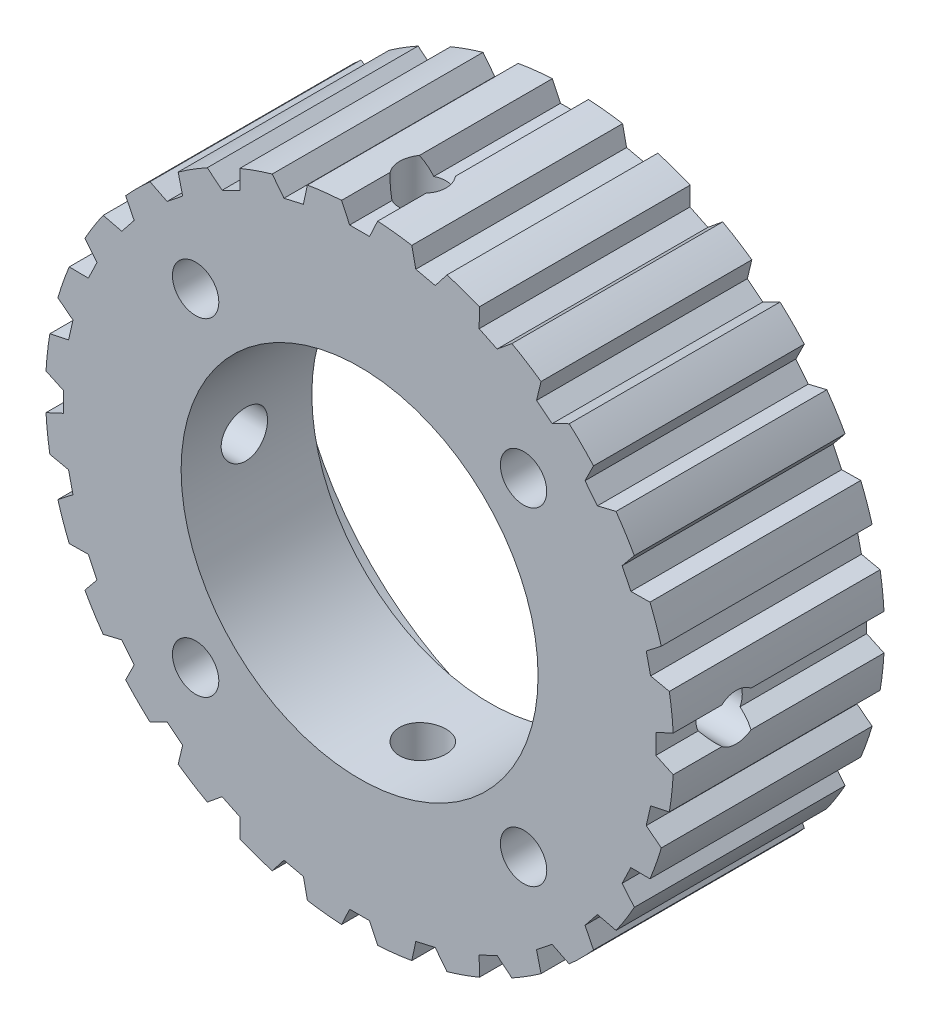
from build123d import *

# Parameters (mm, degrees)
SKETCH1_W                 = 22.35
SKETCH1_H                 = 15
CUT_EXTRUDE1_DEPTH        = 35.986354483
CUT_EXTRUDE2_DEPTH        = 35.986354483
CUT_EXTRUDE3_DEPTH        = 35.986354483
CUT_EXTRUDE4_DEPTH        = 35.986354483
CUT_EXTRUDE5_DEPTH        = 35.986354483
CUT_EXTRUDE6_DEPTH        = 35.986354483
CUT_EXTRUDE7_DEPTH        = 35.986354483
CUT_EXTRUDE8_DEPTH        = 35.986354483
CUT_EXTRUDE9_DEPTH        = 35.986354483
CUT_EXTRUDE10_DEPTH       = 35.986354483
CUT_EXTRUDE11_DEPTH       = 35.986354483
CUT_EXTRUDE12_DEPTH       = 35.986354483
CUT_EXTRUDE13_DEPTH       = 35.986354483
CUT_EXTRUDE14_DEPTH       = 35.986354483
CUT_EXTRUDE15_DEPTH       = 35.986354483
CUT_EXTRUDE16_DEPTH       = 35.986354483
CUT_EXTRUDE17_DEPTH       = 35.986354483
CUT_EXTRUDE18_DEPTH       = 35.986354483
CUT_EXTRUDE19_DEPTH       = 35.986354483
CUT_EXTRUDE20_DEPTH       = 35.986354483
CUT_EXTRUDE21_DEPTH       = 35.962828489
CUT_EXTRUDE22_DEPTH       = 35.962828489
CUT_EXTRUDE23_DEPTH       = 35.962828489
CUT_EXTRUDE24_DEPTH       = 35.962828489
CUT_EXTRUDE25_DEPTH       = 35.962828489
CUT_EXTRUDE26_DEPTH       = 35.962828489
CUT_EXTRUDE27_DEPTH       = 35.962828489
CUT_EXTRUDE28_DEPTH       = 35.939286654
DRAFT1_ANGLE              = 25
DRAFT2_ANGLE              = 25
DRAFT3_ANGLE              = 25
DRAFT4_ANGLE              = 25
DRAFT5_ANGLE              = 25
DRAFT6_ANGLE              = 25
DRAFT7_ANGLE              = 25
DRAFT8_ANGLE              = 25
HOLE1_D                   = 25.4
HOLE1_CBORE_D             = 40
HOLE1_CBORE_DEPTH         = 5.7
F_4_CLEARANCE_HOLE1_D     = 3.3
F_4_CLEARANCE_HOLE1_DEPTH = 9.72079598
F_4_CLEARANCE_HOLE2_D     = 3.3
F_4_CLEARANCE_HOLE2_DEPTH = 9.72079598
F_4_CLEARANCE_HOLE3_D     = 3.3
F_4_CLEARANCE_HOLE3_DEPTH = 9.72079598
F_4_CLEARANCE_HOLE4_D     = 3.3
F_4_CLEARANCE_HOLE4_DEPTH = 9.72079598
F_4_CLEARANCE_HOLE5_D     = 3.3
F_4_CLEARANCE_HOLE5_DEPTH = 15


with BuildPart() as part:
    # Sketch1 → Revolve1 (revolve)
    with BuildSketch(Plane.XZ, mode=Mode.PRIVATE) as revolve1_sk:
        with Locations((11.175, 7.5)):
            Rectangle(SKETCH1_W, SKETCH1_H)
    revolve(revolve1_sk.sketch.rotate(Axis((0, 0, 15), (0, 0, -1)), 180), axis=Axis((0, 0, 15), (0, 0, -1)))

    # Sketch2 → Cut-Extrude1 (cut, through all)
    with BuildSketch(Plane.XY.offset(15)):
        with BuildLine():
            Line((8.525535233, 20.660052008), (8.50857312, 19.299521992))
            Line((8.50857312, 19.299521992), (10.50433369, 19.27464028))
            Line((10.50433369, 19.27464028), (10.837094817, 19.546863583))
            ThreePointArc((10.837094817, 19.546863583), (9.697301569, 20.136654198), (8.525535233, 20.660052008))
        make_face()
    extrude(amount=-CUT_EXTRUDE1_DEPTH, mode=Mode.SUBTRACT)

    # Sketch3 → Cut-Extrude2 (cut, through all)
    with BuildSketch(Plane.XY.offset(15)):
        with BuildLine():
            Line((12.909076333, 18.244951308), (12.589793086, 16.922307045))
            Line((12.589793086, 16.922307045), (13.696536961, 16.039708256))
            Line((13.696536961, 16.039708256), (14.914972564, 16.645302443))
            ThreePointArc((14.914972564, 16.645302443), (13.934997072, 17.473933633), (12.909076333, 18.244951308))
        make_face()
    extrude(amount=-CUT_EXTRUDE2_DEPTH, mode=Mode.SUBTRACT)

    # Sketch4 → Cut-Extrude3 (cut, through all)
    with BuildSketch(Plane.XY.offset(15)):
        with BuildLine():
            Line((16.645302443, 14.914972564), (16.039708256, 13.696536961))
            Line((16.039708256, 13.696536961), (16.922307045, 12.589793086))
            Line((16.922307045, 12.589793086), (18.244951308, 12.909076333))
            ThreePointArc((18.244951308, 12.909076333), (17.473933633, 13.934997072), (16.645302443, 14.914972564))
        make_face()
    extrude(amount=-CUT_EXTRUDE3_DEPTH, mode=Mode.SUBTRACT)

    # Sketch5 → Cut-Extrude4 (cut, through all)
    with BuildSketch(Plane.XY.offset(15)):
        with BuildLine():
            Line((19.546863583, 10.837094817), (19.27464028, 10.50433369))
            Line((19.27464028, 10.50433369), (19.299521992, 8.50857312))
            Line((19.299521992, 8.50857312), (20.660052008, 8.525535233))
            ThreePointArc((20.660052008, 8.525535233), (20.136654198, 9.697301569), (19.546863583, 10.837094817))
        make_face()
    extrude(amount=-CUT_EXTRUDE4_DEPTH, mode=Mode.SUBTRACT)

    # Sketch6 → Cut-Extrude5 (cut, through all)
    with BuildSketch(Plane.XY.offset(15)):
        with BuildLine():
            Line((21.468263363, 6.215799883), (20.393982458, 5.380784807))
            Line((20.393982458, 5.380784807), (20.708978319, 4.000697768))
            Line((20.708978319, 4.000697768), (22.039171433, 3.714488196))
            ThreePointArc((22.039171433, 3.714488196), (21.789638837, 4.973342874), (21.468263363, 6.215799883))
        make_face()
    extrude(amount=-CUT_EXTRUDE5_DEPTH, mode=Mode.SUBTRACT)

    # Sketch7 → Cut-Extrude6 (cut, through all)
    with BuildSketch(Plane.XY.offset(15)):
        with BuildLine():
            Line((22.313154774, 1.282818789), (21.08, 0.707789274))
            Line((21.08, 0.707789274), (21.08, -0.707789274))
            Line((21.08, -0.707789274), (22.313154774, -1.282818789))
            ThreePointArc((22.313154774, -1.282818789), (22.35, 0), (22.313154774, 1.282818789))
        make_face()
    extrude(amount=-CUT_EXTRUDE6_DEPTH, mode=Mode.SUBTRACT)

    # Sketch8 → Cut-Extrude7 (cut, through all)
    with BuildSketch(Plane.XY.offset(15)):
        with BuildLine():
            Line((22.039171433, -3.714488196), (20.708978319, -4.000697768))
            Line((20.708978319, -4.000697768), (20.393982458, -5.380784807))
            Line((20.393982458, -5.380784807), (21.468263363, -6.215799883))
            ThreePointArc((21.468263363, -6.215799883), (21.789638837, -4.973342874), (22.039171433, -3.714488196))
        make_face()
    extrude(amount=-CUT_EXTRUDE7_DEPTH, mode=Mode.SUBTRACT)

    # Sketch9 → Cut-Extrude8 (cut, through all)
    with BuildSketch(Plane.XY.offset(15)):
        with BuildLine():
            Line((20.660052008, -8.525535233), (19.299521992, -8.50857312))
            Line((19.299521992, -8.50857312), (19.27464028, -10.50433369))
            Line((19.27464028, -10.50433369), (19.546863583, -10.837094817))
            ThreePointArc((19.546863583, -10.837094817), (20.136654198, -9.697301569), (20.660052008, -8.525535233))
        make_face()
    extrude(amount=-CUT_EXTRUDE8_DEPTH, mode=Mode.SUBTRACT)

    # Sketch10 → Cut-Extrude9 (cut, through all)
    with BuildSketch(Plane.XY.offset(15)):
        with BuildLine():
            Line((18.244951308, -12.909076333), (16.922307045, -12.589793086))
            Line((16.922307045, -12.589793086), (16.039708256, -13.696536961))
            Line((16.039708256, -13.696536961), (16.645302443, -14.914972564))
            ThreePointArc((16.645302443, -14.914972564), (17.473933633, -13.934997072), (18.244951308, -12.909076333))
        make_face()
    extrude(amount=-CUT_EXTRUDE9_DEPTH, mode=Mode.SUBTRACT)

    # Sketch11 → Cut-Extrude10 (cut, through all)
    with BuildSketch(Plane.XY.offset(15)):
        with BuildLine():
            Line((14.914972564, -16.645302443), (13.696536961, -16.039708256))
            Line((13.696536961, -16.039708256), (12.589793086, -16.922307045))
            Line((12.589793086, -16.922307045), (12.909076333, -18.244951308))
            ThreePointArc((12.909076333, -18.244951308), (13.934997072, -17.473933633), (14.914972564, -16.645302443))
        make_face()
    extrude(amount=-CUT_EXTRUDE10_DEPTH, mode=Mode.SUBTRACT)

    # Sketch12 → Cut-Extrude11 (cut, through all)
    with BuildSketch(Plane.XY.offset(15)):
        with BuildLine():
            Line((10.837094817, -19.546863583), (10.50433369, -19.27464028))
            Line((10.50433369, -19.27464028), (8.50857312, -19.299521992))
            Line((8.50857312, -19.299521992), (8.525535233, -20.660052008))
            ThreePointArc((8.525535233, -20.660052008), (9.697301569, -20.136654198), (10.837094817, -19.546863583))
        make_face()
    extrude(amount=-CUT_EXTRUDE11_DEPTH, mode=Mode.SUBTRACT)

    # Sketch13 → Cut-Extrude12 (cut, through all)
    with BuildSketch(Plane.XY.offset(15)):
        with BuildLine():
            Line((6.215799883, -21.468263363), (5.380784807, -20.393982458))
            Line((5.380784807, -20.393982458), (4.000697768, -20.708978319))
            Line((4.000697768, -20.708978319), (3.714488196, -22.039171433))
            ThreePointArc((3.714488196, -22.039171433), (4.973342874, -21.789638837), (6.215799883, -21.468263363))
        make_face()
    extrude(amount=-CUT_EXTRUDE12_DEPTH, mode=Mode.SUBTRACT)

    # Sketch14 → Cut-Extrude13 (cut, through all)
    with BuildSketch(Plane.XY.offset(15)):
        with BuildLine():
            Line((1.282818789, -22.313154774), (0.707789274, -21.08))
            Line((0.707789274, -21.08), (-0.707789274, -21.08))
            Line((-0.707789274, -21.08), (-1.282818789, -22.313154774))
            ThreePointArc((-1.282818789, -22.313154774), (0, -22.35), (1.282818789, -22.313154774))
        make_face()
    extrude(amount=-CUT_EXTRUDE13_DEPTH, mode=Mode.SUBTRACT)

    # Sketch15 → Cut-Extrude14 (cut, through all)
    with BuildSketch(Plane.XY.offset(15)):
        with BuildLine():
            Line((-3.714488196, -22.039171433), (-4.000697768, -20.708978319))
            Line((-4.000697768, -20.708978319), (-5.380784807, -20.393982458))
            Line((-5.380784807, -20.393982458), (-6.215799883, -21.468263363))
            ThreePointArc((-6.215799883, -21.468263363), (-4.973342874, -21.789638837), (-3.714488196, -22.039171433))
        make_face()
    extrude(amount=-CUT_EXTRUDE14_DEPTH, mode=Mode.SUBTRACT)

    # Sketch16 → Cut-Extrude15 (cut, through all)
    with BuildSketch(Plane.XY.offset(15)):
        with BuildLine():
            Line((-8.525535233, -20.660052008), (-8.50857312, -19.299521992))
            Line((-8.50857312, -19.299521992), (-10.50433369, -19.27464028))
            Line((-10.50433369, -19.27464028), (-10.837094817, -19.546863583))
            ThreePointArc((-10.837094817, -19.546863583), (-9.697301569, -20.136654198), (-8.525535233, -20.660052008))
        make_face()
    extrude(amount=-CUT_EXTRUDE15_DEPTH, mode=Mode.SUBTRACT)

    # Sketch17 → Cut-Extrude16 (cut, through all)
    with BuildSketch(Plane.XY.offset(15)):
        with BuildLine():
            Line((-12.909076333, -18.244951308), (-12.589793086, -16.922307045))
            Line((-12.589793086, -16.922307045), (-13.696536961, -16.039708256))
            Line((-13.696536961, -16.039708256), (-14.914972564, -16.645302443))
            ThreePointArc((-14.914972564, -16.645302443), (-13.934997072, -17.473933633), (-12.909076333, -18.244951308))
        make_face()
    extrude(amount=-CUT_EXTRUDE16_DEPTH, mode=Mode.SUBTRACT)

    # Sketch18 → Cut-Extrude17 (cut, through all)
    with BuildSketch(Plane.XY.offset(15)):
        with BuildLine():
            Line((-16.645302443, -14.914972564), (-16.039708256, -13.696536961))
            Line((-16.039708256, -13.696536961), (-16.922307045, -12.589793086))
            Line((-16.922307045, -12.589793086), (-18.244951308, -12.909076333))
            ThreePointArc((-18.244951308, -12.909076333), (-17.473933633, -13.934997072), (-16.645302443, -14.914972564))
        make_face()
    extrude(amount=-CUT_EXTRUDE17_DEPTH, mode=Mode.SUBTRACT)

    # Sketch19 → Cut-Extrude18 (cut, through all)
    with BuildSketch(Plane.XY.offset(15)):
        with BuildLine():
            Line((-19.546863583, -10.837094817), (-19.27464028, -10.50433369))
            Line((-19.27464028, -10.50433369), (-19.299521992, -8.50857312))
            Line((-19.299521992, -8.50857312), (-20.660052008, -8.525535233))
            ThreePointArc((-20.660052008, -8.525535233), (-20.136654198, -9.697301569), (-19.546863583, -10.837094817))
        make_face()
    extrude(amount=-CUT_EXTRUDE18_DEPTH, mode=Mode.SUBTRACT)

    # Sketch20 → Cut-Extrude19 (cut, through all)
    with BuildSketch(Plane.XY.offset(15)):
        with BuildLine():
            Line((-21.468263363, -6.215799883), (-20.393982458, -5.380784807))
            Line((-20.393982458, -5.380784807), (-20.708978319, -4.000697768))
            Line((-20.708978319, -4.000697768), (-22.039171433, -3.714488196))
            ThreePointArc((-22.039171433, -3.714488196), (-21.789638837, -4.973342874), (-21.468263363, -6.215799883))
        make_face()
    extrude(amount=-CUT_EXTRUDE19_DEPTH, mode=Mode.SUBTRACT)

    # Sketch21 → Cut-Extrude20 (cut, through all)
    with BuildSketch(Plane.XY.offset(15)):
        with BuildLine():
            Line((-22.313154774, -1.282818789), (-21.08, -0.707789274))
            Line((-21.08, -0.707789274), (-21.08, 0.707789274))
            Line((-21.08, 0.707789274), (-22.313154774, 1.282818789))
            ThreePointArc((-22.313154774, 1.282818789), (-22.35, 0), (-22.313154774, -1.282818789))
        make_face()
    extrude(amount=-CUT_EXTRUDE20_DEPTH, mode=Mode.SUBTRACT)

    # Sketch22 → Cut-Extrude21 (cut, through all)
    with BuildSketch(Plane.XY.offset(15)):
        with BuildLine():
            Line((-22.039171433, 3.714488196), (-20.708978319, 4.000697768))
            Line((-20.708978319, 4.000697768), (-20.393982458, 5.380784807))
            Line((-20.393982458, 5.380784807), (-21.468263363, 6.215799883))
            ThreePointArc((-21.468263363, 6.215799883), (-21.789638837, 4.973342874), (-22.039171433, 3.714488196))
        make_face()
    extrude(amount=-CUT_EXTRUDE21_DEPTH, mode=Mode.SUBTRACT)

    # Sketch23 → Cut-Extrude22 (cut, through all)
    with BuildSketch(Plane.XY.offset(15)):
        with BuildLine():
            Line((-20.660052008, 8.525535233), (-19.299521992, 8.50857312))
            Line((-19.299521992, 8.50857312), (-19.27464028, 10.50433369))
            Line((-19.27464028, 10.50433369), (-19.546863583, 10.837094817))
            ThreePointArc((-19.546863583, 10.837094817), (-20.136654198, 9.697301569), (-20.660052008, 8.525535233))
        make_face()
    extrude(amount=-CUT_EXTRUDE22_DEPTH, mode=Mode.SUBTRACT)

    # Sketch24 → Cut-Extrude23 (cut, through all)
    with BuildSketch(Plane.XY.offset(15)):
        with BuildLine():
            Line((-18.244951308, 12.909076333), (-16.922307045, 12.589793086))
            Line((-16.922307045, 12.589793086), (-16.039708256, 13.696536961))
            Line((-16.039708256, 13.696536961), (-16.645302443, 14.914972564))
            ThreePointArc((-16.645302443, 14.914972564), (-17.473933633, 13.934997072), (-18.244951308, 12.909076333))
        make_face()
    extrude(amount=-CUT_EXTRUDE23_DEPTH, mode=Mode.SUBTRACT)

    # Sketch25 → Cut-Extrude24 (cut, through all)
    with BuildSketch(Plane.XY.offset(15)):
        with BuildLine():
            Line((-14.914972564, 16.645302443), (-13.696536961, 16.039708256))
            Line((-13.696536961, 16.039708256), (-12.589793086, 16.922307045))
            Line((-12.589793086, 16.922307045), (-12.909076333, 18.244951308))
            ThreePointArc((-12.909076333, 18.244951308), (-13.934997072, 17.473933633), (-14.914972564, 16.645302443))
        make_face()
    extrude(amount=-CUT_EXTRUDE24_DEPTH, mode=Mode.SUBTRACT)

    # Sketch26 → Cut-Extrude25 (cut, through all)
    with BuildSketch(Plane.XY.offset(15)):
        with BuildLine():
            Line((-10.837094817, 19.546863583), (-10.50433369, 19.27464028))
            Line((-10.50433369, 19.27464028), (-8.50857312, 19.299521992))
            Line((-8.50857312, 19.299521992), (-8.525535233, 20.660052008))
            ThreePointArc((-8.525535233, 20.660052008), (-9.697301569, 20.136654198), (-10.837094817, 19.546863583))
        make_face()
    extrude(amount=-CUT_EXTRUDE25_DEPTH, mode=Mode.SUBTRACT)

    # Sketch27 → Cut-Extrude26 (cut, through all)
    with BuildSketch(Plane.XY.offset(15)):
        with BuildLine():
            Line((-6.215799883, 21.468263363), (-5.380784807, 20.393982458))
            Line((-5.380784807, 20.393982458), (-4.000697768, 20.708978319))
            Line((-4.000697768, 20.708978319), (-3.714488196, 22.039171433))
            ThreePointArc((-3.714488196, 22.039171433), (-4.973342874, 21.789638837), (-6.215799883, 21.468263363))
        make_face()
    extrude(amount=-CUT_EXTRUDE26_DEPTH, mode=Mode.SUBTRACT)

    # Sketch28 → Cut-Extrude27 (cut, through all)
    with BuildSketch(Plane.XY.offset(15)):
        with BuildLine():
            Line((-1.282818789, 22.313154774), (-0.707789274, 21.08))
            Line((-0.707789274, 21.08), (0.707789274, 21.08))
            Line((0.707789274, 21.08), (1.282818789, 22.313154774))
            ThreePointArc((1.282818789, 22.313154774), (0, 22.35), (-1.282818789, 22.313154774))
        make_face()
    extrude(amount=-CUT_EXTRUDE27_DEPTH, mode=Mode.SUBTRACT)

    # Sketch29 → Cut-Extrude28 (cut, through all)
    with BuildSketch(Plane.XY.offset(15)):
        with BuildLine():
            Line((3.714488196, 22.039171433), (4.000697768, 20.708978319))
            Line((4.000697768, 20.708978319), (5.380784807, 20.393982458))
            Line((5.380784807, 20.393982458), (6.215799883, 21.468263363))
            ThreePointArc((6.215799883, 21.468263363), (4.973342874, 21.789638837), (3.714488196, 22.039171433))
        make_face()
    extrude(amount=-CUT_EXTRUDE28_DEPTH, mode=Mode.SUBTRACT)

    # Draft1
    draft1_faces = [part.faces().sort_by_distance(p)[0] for p in [
        (9.506453405, 19.287081136, 7.5),
    ]]
    draft(draft1_faces, Plane(origin=(8.525535233, 20.660052008, 0), x_dir=(0.012466314595398207, 0.9999222924809751, 0), z_dir=(0.9999222924809751, -0.012466314595398207, 0)), DRAFT1_ANGLE)

    # Draft2
    draft2_faces = [part.faces().sort_by_distance(p)[0] for p in [
        (19.287081136, 9.506453405, 7.5),
    ]]
    draft(draft2_faces, Plane(origin=(19.299521992, 8.50857312, 0), x_dir=(0.9999222924809746, 0.012466314595433963, 0), z_dir=(-0.012466314595433963, 0.9999222924809746, 0)), DRAFT2_ANGLE)

    # Draft3
    draft3_faces = [part.faces().sort_by_distance(p)[0] for p in [
        (19.287081136, -9.506453405, 7.5),
    ]]
    draft(draft3_faces, Plane(origin=(20.660052008, -8.525535233, 0), x_dir=(-0.999922292480975, 0.012466314595404517, 0), z_dir=(-0.012466314595404517, -0.999922292480975, 0)), DRAFT3_ANGLE)

    # Draft4
    draft4_faces = [part.faces().sort_by_distance(p)[0] for p in [
        (9.506453405, -19.287081136, 7.5),
    ]]
    draft(draft4_faces, Plane(origin=(8.50857312, -19.299521992, 0), x_dir=(-0.012466314595428834, 0.9999222924809746, 0), z_dir=(0.9999222924809746, 0.012466314595428834, 0)), DRAFT4_ANGLE)

    # Draft5
    draft5_faces = [part.faces().sort_by_distance(p)[0] for p in [
        (-9.506453405, -19.287081136, 7.5),
    ]]
    draft(draft5_faces, Plane(origin=(-8.525535233, -20.660052008, 0), x_dir=(-0.012466314595400565, -0.999922292480975, 0), z_dir=(-0.999922292480975, 0.012466314595400565, 0)), DRAFT5_ANGLE)

    # Draft6
    draft6_faces = [part.faces().sort_by_distance(p)[0] for p in [
        (-19.287081136, -9.506453405, 7.5),
    ]]
    draft(draft6_faces, Plane(origin=(-19.299521992, -8.50857312, 0), x_dir=(-0.9999222924809748, -0.012466314595424978, 0), z_dir=(0.012466314595424978, -0.9999222924809748, 0)), DRAFT6_ANGLE)

    # Draft7
    draft7_faces = [part.faces().sort_by_distance(p)[0] for p in [
        (-19.287081136, 9.506453405, 7.5),
    ]]
    draft(draft7_faces, Plane(origin=(-20.660052008, 8.525535233, 0), x_dir=(0.9999222924809749, -0.012466314595412262, 0), z_dir=(0.012466314595412262, 0.9999222924809749, 0)), DRAFT7_ANGLE)

    # Draft8
    draft8_faces = [part.faces().sort_by_distance(p)[0] for p in [
        (-9.506453405, 19.287081136, 7.5),
    ]]
    draft(draft8_faces, Plane(origin=(-8.50857312, 19.299521992, 0), x_dir=(0.01246631459542249, -0.9999222924809748, 0), z_dir=(-0.9999222924809748, -0.01246631459542249, 0)), DRAFT8_ANGLE)

    # Hole1 (through all)
    with Locations(Plane(origin=(0, 0, 0), x_dir=(-1, 0, 0), z_dir=(0, 0, -1))):
        with Locations((0, 0)):
            CounterBoreHole(HOLE1_D / 2, HOLE1_CBORE_D / 2, HOLE1_CBORE_DEPTH)

    # #4 Clearance Hole1
    with Locations(Plane.ZY.offset(-12.592358794)):
        with Locations((10.5, 0)):
            Hole(F_4_CLEARANCE_HOLE1_D / 2, depth=F_4_CLEARANCE_HOLE1_DEPTH)

    # #4 Clearance Hole2
    with Locations(Plane(origin=(0, -12.592358794, 0), x_dir=(1, 0, 0), z_dir=(0, 1, 0))):
        with Locations((0, -10.5)):
            Hole(F_4_CLEARANCE_HOLE2_D / 2, depth=F_4_CLEARANCE_HOLE2_DEPTH)

    # #4 Clearance Hole3
    with Locations(Plane(origin=(-12.592358794, 0, 0), x_dir=(0, 0, -1), z_dir=(1, 0, 0))):
        with Locations((-10.5, 0)):
            Hole(F_4_CLEARANCE_HOLE3_D / 2, depth=F_4_CLEARANCE_HOLE3_DEPTH)

    # #4 Clearance Hole4
    with Locations(Plane(origin=(0, 12.592358794, 0), x_dir=(-1, 0, 0), z_dir=(0, -1, 0))):
        with Locations((0, -10.5)):
            Hole(F_4_CLEARANCE_HOLE4_D / 2, depth=F_4_CLEARANCE_HOLE4_DEPTH)

    # #4 Clearance Hole5
    with Locations(Plane.XY.offset(15)):
        with Locations((11.66726189, -11.66726189), (-11.66726189, -11.66726189), (-11.66726189, 11.66726189), (11.66726189, 11.66726189)):
            Hole(F_4_CLEARANCE_HOLE5_D / 2, depth=F_4_CLEARANCE_HOLE5_DEPTH)


solid = part.part
